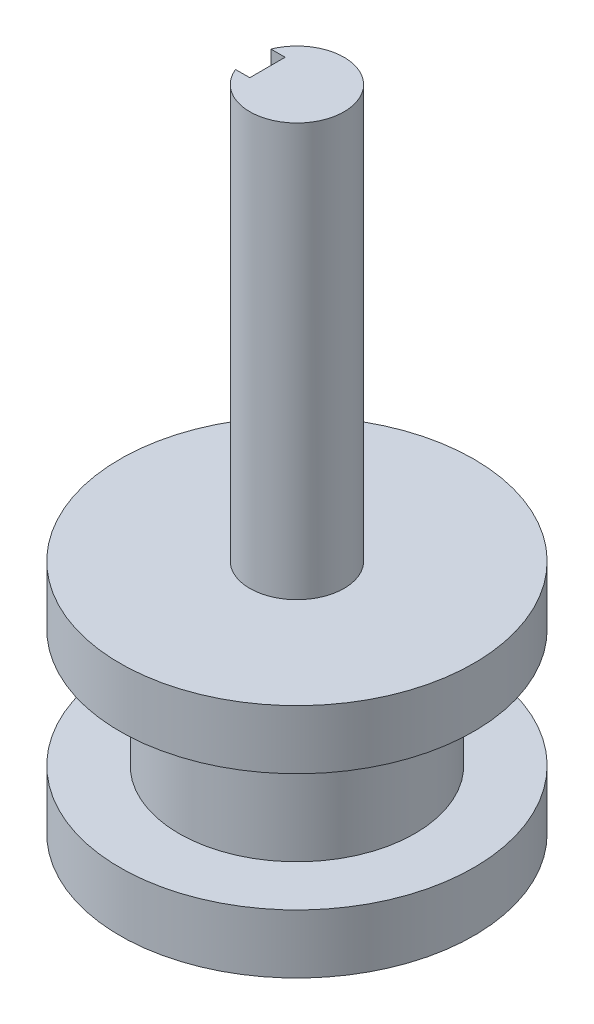
from build123d import *

# Parameters (mm, degrees)
SKETCH1_R           = 4
BOSS_EXTRUDE1_DEPTH = 35
SKETCH4_W           = 3
SKETCH4_H           = 3
CUT_EXTRUDE3_DEPTH  = 5
SKETCH5_R           = 15
BOSS_EXTRUDE2_DEPTH = 5
SKETCH6_R           = 10
BOSS_EXTRUDE3_DEPTH = 10
SKETCH7_R           = 15
BOSS_EXTRUDE4_DEPTH = 5


with BuildPart() as part:
    # Sketch1 → Boss-Extrude1 (new body)
    with BuildSketch(Plane(origin=(0, 0, 0), x_dir=(1, 0, 0), z_dir=(0, 1, 0))):
        with Locations(Location((0, 0, 0), (0, 0, 270))):
            Circle(SKETCH1_R)
    extrude(amount=BOSS_EXTRUDE1_DEPTH)

    # Sketch4 → Cut-Extrude3 (cut)
    with BuildSketch(Plane(origin=(0, 35, 0), x_dir=(1, 0, 0), z_dir=(0, 1, 0))):
        with Locations((-4, 0)):
            Rectangle(SKETCH4_W, SKETCH4_H)
    extrude(amount=-CUT_EXTRUDE3_DEPTH, mode=Mode.SUBTRACT)

    # Sketch5 → Boss-Extrude2 (add)
    with BuildSketch(Plane.XZ):
        with Locations(Location((0, 0, 0), (0, 0, 270))):
            Circle(SKETCH5_R)
    extrude(amount=BOSS_EXTRUDE2_DEPTH)

    # Sketch6 → Boss-Extrude3 (add)
    with BuildSketch(Plane.XZ.offset(5)):
        with Locations(Location((0, 0, 0), (0, 0, 270))):
            Circle(SKETCH6_R)
    extrude(amount=BOSS_EXTRUDE3_DEPTH)

    # Sketch7 → Boss-Extrude4 (add)
    with BuildSketch(Plane.XZ.offset(15)):
        with Locations(Location((0, 0, 0), (0, 0, 270))):
            Circle(SKETCH7_R)
    extrude(amount=BOSS_EXTRUDE4_DEPTH)


solid = part.part
